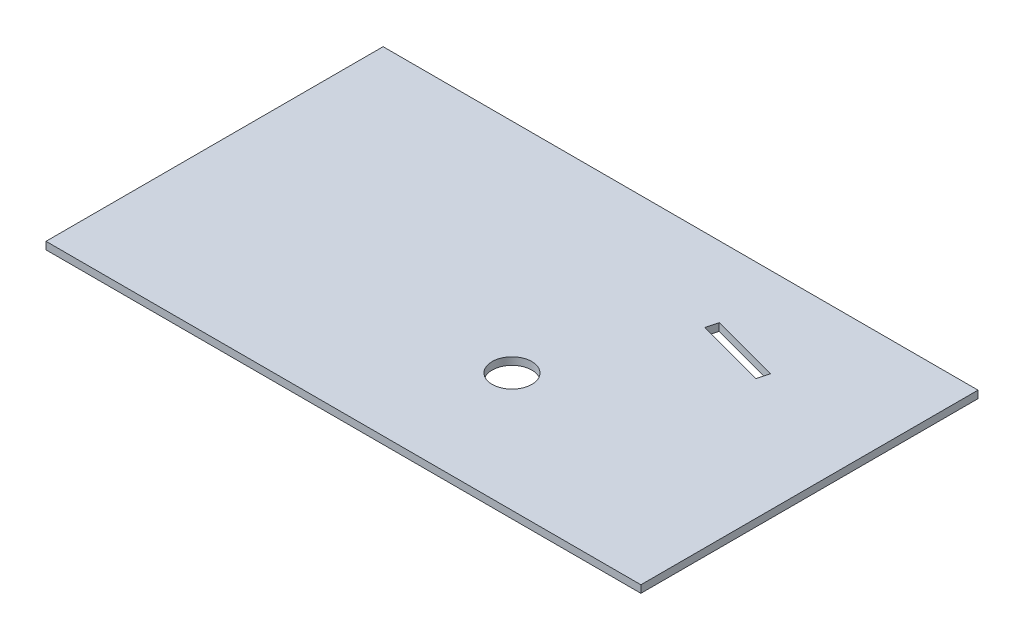
from build123d import *

# Parameters (mm, degrees)
BOSS_EXTRUDE1_DEPTH    = 50.8
SKETCH4_W              = 1524
SKETCH4_H              = 863.6
BOSS_EXTRUDE2_DEPTH    = 19.05
F_20_0MM_DOWEL_HOLE1_D = 101.6
SKETCH8_W              = 1.5875
SKETCH8_H              = 50.8
BOSS_EXTRUDE3_DEPTH    = 204
CUT_EXTRUDE1_DEPTH     = 1052.265465998


with BuildPart() as part:
    # Sketch3 → Boss-Extrude1 (new body)
    with BuildSketch(Plane(origin=(0, 0, 0), x_dir=(1, 0, 0), z_dir=(0, 1, 0))):
        with BuildLine():
            Line((-524, 0), (-525.5875, 0))
            ThreePointArc((-525.5875, 0), (-255.243310314, 459.448661655), (277.677694458, 446.248045549))
            Line((277.677694458, 446.248045549), (277.677694458, 444.377202386))
            ThreePointArc((277.677694458, 444.377202386), (-254.040241009, 458.300726541), (-524, 0))
        make_face()
    extrude(amount=BOSS_EXTRUDE1_DEPTH)

    # Sketch4 → Boss-Extrude2 (add)
    with BuildSketch(Plane(origin=(0, 50.8, 0), x_dir=(1, 0, 0), z_dir=(0, 1, 0))):
        with Locations((-127, 127)):
            Rectangle(SKETCH4_W, SKETCH4_H)
    extrude(amount=BOSS_EXTRUDE2_DEPTH)

    # Ø20.0mm Dowel Hole1 (through all)
    with Locations(Plane(origin=(0, 50.8, 0), x_dir=(-1, 0, 0), z_dir=(0, -1, 0))):
        with Locations((0, 0)):
            Hole(F_20_0MM_DOWEL_HOLE1_D / 2)

    # Sketch8 → Boss-Extrude3 (add)
    with BuildSketch(Plane.XY):
        with Locations((-524.79375, 25.4)):
            Rectangle(SKETCH8_W, SKETCH8_H)
    extrude(amount=BOSS_EXTRUDE3_DEPTH)

    # Sketch9 → Cut-Extrude1 (cut, through all)
    with BuildSketch(Plane(origin=(0, 50.8, 0), x_dir=(-1, 0, 0), z_dir=(0, -1, 0))):
        Polygon((-154.06829349, 376.859298133), (-332.764571353, 328.977774789), (-325, 300), (-146.303722137, 347.881523344), align=None)
    extrude(amount=-CUT_EXTRUDE1_DEPTH, mode=Mode.SUBTRACT)


solid = part.part
